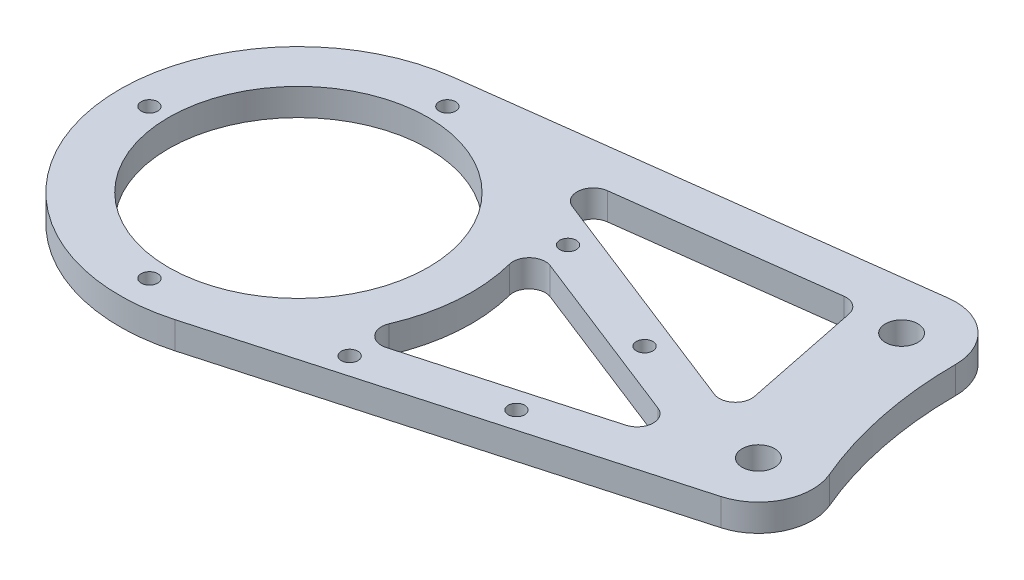
from build123d import *

# Parameters (mm, degrees)
SKETCH_1_R          = 33
SKETCH_1_R_2        = 13.1
SKETCH_1_R_3        = 2.025
SKETCH_1_R_4        = 10
SKETCH_1_R_5        = 3
EXTRUDE_1_DEPTH     = 5
SKETCH_3_R          = 24
CUT_EXTRUDE_2_DEPTH = 10
CUT_EXTRUDE_3_DEPTH = 10
FILLET_1_R          = 3
SKETCH_7_R          = 1.525
CUT_EXTRUDE_4_DEPTH = 10


with BuildPart() as part:
    # 草图1 → 凸台-拉伸1 (new body)
    # profile 1 of 4: a face of its own
    with BuildSketch(Plane(origin=(0, 0, 0), x_dir=(1, 0, 0), z_dir=(0, 1, 0))):
        with BuildLine():
            ThreePointArc((33, 0), (26.302762101, -19.928991592), (8.929411765, -31.768940894))
            Line((8.929411765, -31.768940894), (87.705882353, -9.626951786))
            ThreePointArc((87.705882353, -9.626951786), (75.985476525, 4.328783491), (94.205048973, 3.907310252))
            ThreePointArc((94.205048973, 3.907310252), (89.748559809, 18.25955029), (88.242912543, 33.212145922))
            ThreePointArc((88.242912543, 33.212145922), (71.63638997, 25.705225149), (76.972140647, 43.13107423))
            Line((76.972140647, 43.13107423), (-4.193547259, 32.732463418))
            ThreePointArc((-4.193547259, 32.732463418), (21.801524493, 24.772838549), (33, 0))
        make_face()
    # profile 2 of 4: a face of its own
    with BuildSketch(Plane(origin=(0, 0, 0), x_dir=(1, 0, 0), z_dir=(0, 1, 0))):
        Circle(SKETCH_1_R)
        with Locations(Location((0, 0, 0), (0, 0, 270))):
            Circle(SKETCH_1_R_2, mode=Mode.SUBTRACT)
        with Locations(Location((0, 17.5, 0), (0, 0, 270))):
            Circle(SKETCH_1_R_3, mode=Mode.SUBTRACT)
        with Locations(Location((8.75, 15.155444566, 0), (0, 0, 270))):
            Circle(SKETCH_1_R_3, mode=Mode.SUBTRACT)
        with Locations(Location((15.155444566, 8.75, 0), (0, 0, 270))):
            Circle(SKETCH_1_R_3, mode=Mode.SUBTRACT)
        with Locations(Location((17.5, 0, 0), (0, 0, 270))):
            Circle(SKETCH_1_R_3, mode=Mode.SUBTRACT)
        with Locations(Location((15.155444566, -8.75, 0), (0, 0, 270))):
            Circle(SKETCH_1_R_3, mode=Mode.SUBTRACT)
        with Locations(Location((8.75, -15.155444566, 0), (0, 0, 270))):
            Circle(SKETCH_1_R_3, mode=Mode.SUBTRACT)
        with Locations(Location((0, -17.5, 0), (0, 0, 270))):
            Circle(SKETCH_1_R_3, mode=Mode.SUBTRACT)
        with Locations(Location((-8.75, -15.155444566, 0), (0, 0, 270))):
            Circle(SKETCH_1_R_3, mode=Mode.SUBTRACT)
        with Locations(Location((-15.155444566, -8.75, 0), (0, 0, 270))):
            Circle(SKETCH_1_R_3, mode=Mode.SUBTRACT)
        with Locations(Location((-17.5, 0, 0), (0, 0, 270))):
            Circle(SKETCH_1_R_3, mode=Mode.SUBTRACT)
        with Locations(Location((-15.155444566, 8.75, 0), (0, 0, 270))):
            Circle(SKETCH_1_R_3, mode=Mode.SUBTRACT)
        with Locations(Location((-8.75, 15.155444566, 0), (0, 0, 270))):
            Circle(SKETCH_1_R_3, mode=Mode.SUBTRACT)
    # profile 3 of 4: a face of its own
    with BuildSketch(Plane(origin=(0, 0, 0), x_dir=(1, 0, 0), z_dir=(0, 1, 0))):
        with Locations((85, 0)):
            Circle(SKETCH_1_R_4)
        with Locations(Location((85, 0, 0), (0, 0, 270))):
            Circle(SKETCH_1_R_5, mode=Mode.SUBTRACT)
    # profile 4 of 4: a face of its own
    with BuildSketch(Plane(origin=(0, 0, 0), x_dir=(1, 0, 0), z_dir=(0, 1, 0))):
        with Locations((78.242912543, 33.212145922)):
            Circle(SKETCH_1_R_4)
        with Locations(Location((78.242912543, 33.212145922, 0), (0, 0, 270))):
            Circle(SKETCH_1_R_5, mode=Mode.SUBTRACT)
    extrude(amount=EXTRUDE_1_DEPTH)

    # 草图3 → 切除-拉伸2 (cut)
    with BuildSketch(Plane(origin=(0, 5, 0), x_dir=(1, 0, 0), z_dir=(0, 1, 0))):
        with Locations(Location((0, 0, 0), (0, 0, 270))):
            Circle(SKETCH_3_R)
    extrude(amount=-CUT_EXTRUDE_2_DEPTH, mode=Mode.SUBTRACT)

    # 草图4 → 切除-拉伸3 (cut)
    with BuildSketch(Plane(origin=(0, 5, 0), x_dir=(1, 0, 0), z_dir=(0, 1, 0))):
        Polygon((69.770383541, 34.143027562), (75.881597407, 4.105451761), (16.636114037, 27.335685646), align=None)
        with BuildLine():
            ThreePointArc((32, 0), (30.461655113, -9.802426627), (25.994527014, -18.662383699))
            Line((25.994527014, -18.662383699), (76.108728609, -4.576602785))
            Line((76.108728609, -4.576602785), (28.785186198, 13.979021981))
            ThreePointArc((28.785186198, 13.979021981), (31.185942012, 7.171960739), (32, 0))
        make_face()
    extrude(amount=-CUT_EXTRUDE_3_DEPTH, mode=Mode.SUBTRACT)

    # 圆角1
    fillet_1_edges = [part.edges().sort_by_distance(p)[0] for p in [
        (25.994527014, 2.5, 18.662383699),
        (28.785186198, 2.5, -13.979021981),
        (76.108728609, 2.5, 4.576602785),
        (69.770383541, 2.5, -34.143027562),
        (75.881597407, 2.5, -4.105451761),
        (16.636114037, 2.5, -27.335685646),
    ]]
    fillet(fillet_1_edges, radius=FILLET_1_R)

    # 草图7 → 切除-拉伸4 (cut)
    with BuildSketch(Plane.XZ):
        with Locations(Location((0, -27.522163408, 0), (0, 0, 270))):
            Circle(SKETCH_7_R)
        with Locations(Location((33.321534862, -16.496811603, 0), (0, 0, 270))):
            Circle(SKETCH_7_R)
        with Locations(Location((-27.522163408, 0, 0), (0, 0, 270))):
            Circle(SKETCH_7_R)
        with Locations(Location((0, 27.522163408, 0), (0, 0, 270))):
            Circle(SKETCH_7_R)
        with Locations(Location((30.901702525, 21.438107622, 0), (0, 0, 270))):
            Circle(SKETCH_7_R)
        with Locations(Location((56.596303964, -7.370743267, 0), (0, 0, 270))):
            Circle(SKETCH_7_R)
        with Locations(Location((54.969081991, 14.673401739, 0), (0, 0, 270))):
            Circle(SKETCH_7_R)
    extrude(amount=-CUT_EXTRUDE_4_DEPTH, mode=Mode.SUBTRACT)


solid = part.part
